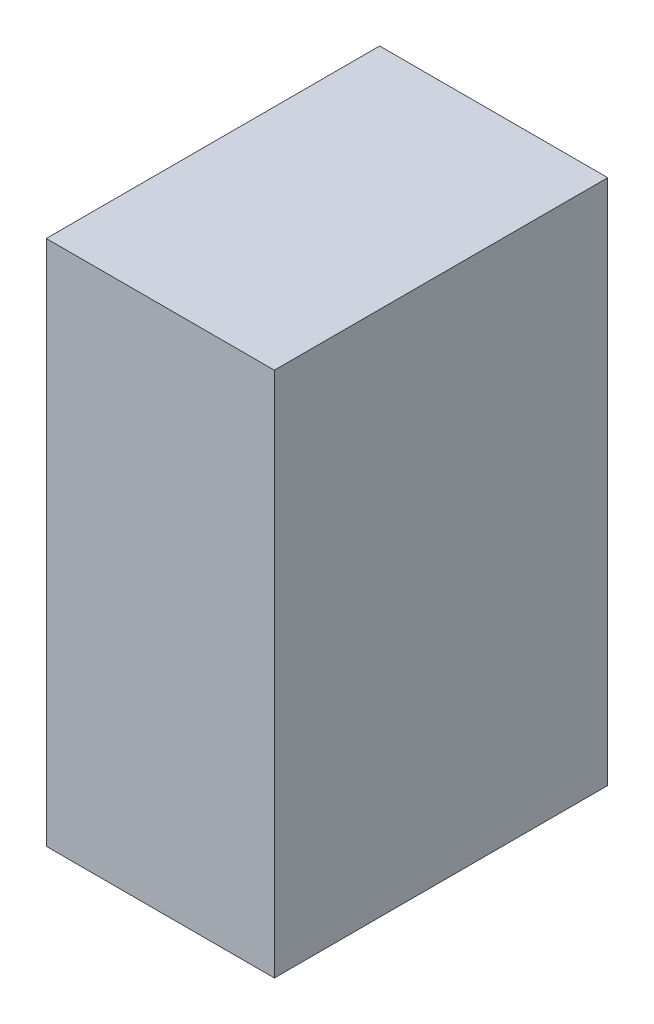
from build123d import *

# Parameters (mm, degrees)
SKETCH1_W           = 150
SKETCH1_H           = 95
BOSS_EXTRUDE1_DEPTH = 32.5


with BuildPart() as part:
    # Sketch1 → Boss-Extrude1 (new body)
    with BuildSketch(Plane.YZ):
        with Locations((75, 47.5)):
            Rectangle(SKETCH1_W, SKETCH1_H)
    extrude(amount=-BOSS_EXTRUDE1_DEPTH)

    # Mirror1: part across plane


with BuildPart() as part_1:
    add(part.part)
    add(part.part.mirror(Plane.ZY))


solid = part_1.part
